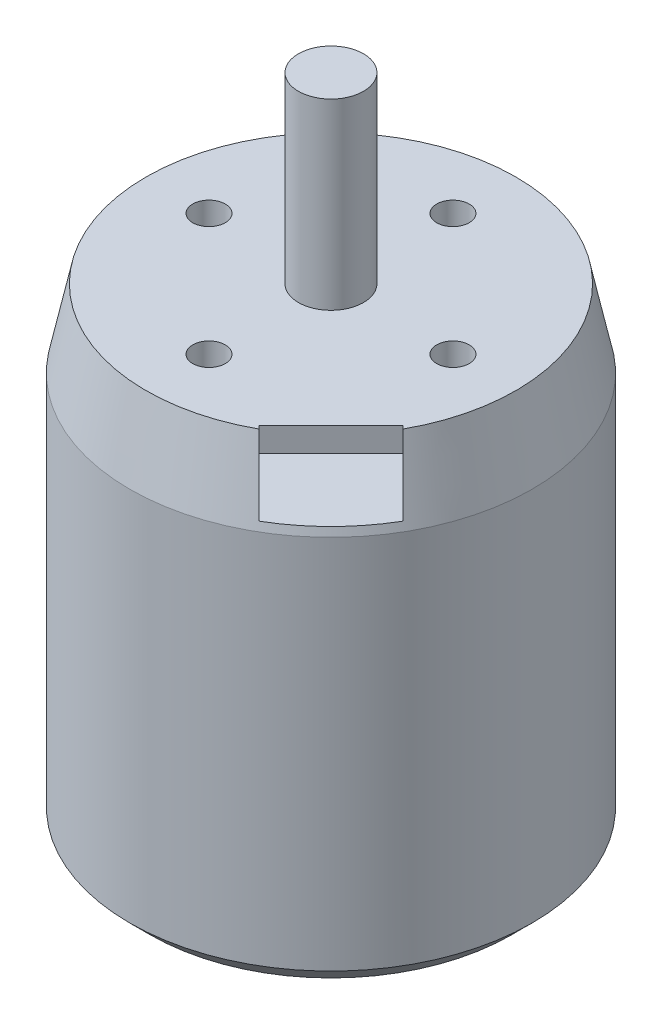
from build123d import *

# Parameters (mm, degrees)
SKETCH1_R           = 24.75
BOSS_EXTRUDE1_DEPTH = 58.2
SKETCH2_R           = 4
BOSS_EXTRUDE2_DEPTH = 22.5
CHAMFER1_SIZE       = 2.5
SKETCH3_R           = 6.8
BOSS_EXTRUDE3_DEPTH = 2
FILLET1_R           = 0.5
SKETCH4_R           = 2
CUT_EXTRUDE1_DEPTH  = 10
SKETCH5_R           = 1.5
CUT_EXTRUDE2_DEPTH  = 5
CHAMFER2_SIZE       = 9.5
CHAMFER2_SIZE2      = 2
CUT_EXTRUDE3_DEPTH  = 8.5
SKETCH7_W           = 12.5
SKETCH7_H           = 5.5
CUT_EXTRUDE4_DEPTH  = 8.5


with BuildPart() as part:
    # Sketch1 → Boss-Extrude1 (new body)
    with BuildSketch(Plane(origin=(0, 0, 0), x_dir=(1, 0, 0), z_dir=(0, 1, 0))):
        Circle(SKETCH1_R)
    extrude(amount=BOSS_EXTRUDE1_DEPTH)

    # Sketch2 → Boss-Extrude2 (add)
    with BuildSketch(Plane(origin=(0, 58.2, 0), x_dir=(1, 0, 0), z_dir=(0, 1, 0))):
        Circle(SKETCH2_R)
    extrude(amount=BOSS_EXTRUDE2_DEPTH)

    # Chamfer1
    chamfer1_edges = [part.edges().sort_by_distance(p)[0] for p in [
        (-24.75, 0, 0),
    ]]
    chamfer(chamfer1_edges, length=CHAMFER1_SIZE)

    # Sketch3 → Boss-Extrude3 (add)
    with BuildSketch(Plane.XZ):
        Circle(SKETCH3_R)
    extrude(amount=BOSS_EXTRUDE3_DEPTH)

    # Fillet1
    fillet1_edges = [part.edges().sort_by_distance(p)[0] for p in [
        (-6.8, 0, 0),
    ]]
    fillet(fillet1_edges, radius=FILLET1_R)

    # Sketch4 → Cut-Extrude1 (cut)
    with BuildSketch(Plane(origin=(0, 58.2, 0), x_dir=(1, 0, 0), z_dir=(0, 1, 0))):
        with Locations((0, 15)):
            Circle(SKETCH4_R)
        with Locations((15, 0)):
            Circle(SKETCH4_R)
        with Locations((0, -15)):
            Circle(SKETCH4_R)
        with Locations((-15, 0)):
            Circle(SKETCH4_R)
    extrude(amount=-CUT_EXTRUDE1_DEPTH, mode=Mode.SUBTRACT)

    # Sketch5 → Cut-Extrude2 (cut)
    with BuildSketch(Plane.XZ):
        with Locations((0, 9.875)):
            Circle(SKETCH5_R)
        with Locations((9.875, 0)):
            Circle(SKETCH5_R)
        with Locations((0, -9.875)):
            Circle(SKETCH5_R)
        with Locations((-9.875, 0)):
            Circle(SKETCH5_R)
    extrude(amount=-CUT_EXTRUDE2_DEPTH, mode=Mode.SUBTRACT)

    # Chamfer2
    chamfer2_edges = [part.edges().sort_by_distance(p)[0] for p in [
        (-24.75, 58.2, 0),
    ]]
    chamfer2_side = [part.faces().sort_by_distance(p)[0] for p in [
        (-24.75, 30.35, 0),
    ]]
    chamfer(chamfer2_edges, length=CHAMFER2_SIZE, length2=CHAMFER2_SIZE2, reference=chamfer2_side[0])

    # Sketch6 → Cut-Extrude3 (cut)
    with BuildSketch(Plane(origin=(0, 58.2, 0), x_dir=(1, 0, 0), z_dir=(0, 1, 0))):
        Polygon((19.516147161, -10.677312396), (10.677312396, -19.516147161), (17.748380208, -26.587214973), (26.587214973, -17.748380208), align=None)
    extrude(amount=-CUT_EXTRUDE3_DEPTH, mode=Mode.SUBTRACT)

    # Sketch7 → Cut-Extrude4 (cut)
    with BuildSketch(Plane(origin=(15.096729778, 0, 15.096729778), x_dir=(0.7071067811865476, 0, -0.7071067811865476), z_dir=(0.7071067811865476, 0, 0.7071067811865476))):
        with Locations((0, 52.45)):
            Rectangle(SKETCH7_W, SKETCH7_H)
    extrude(amount=-CUT_EXTRUDE4_DEPTH, mode=Mode.SUBTRACT)


solid = part.part
